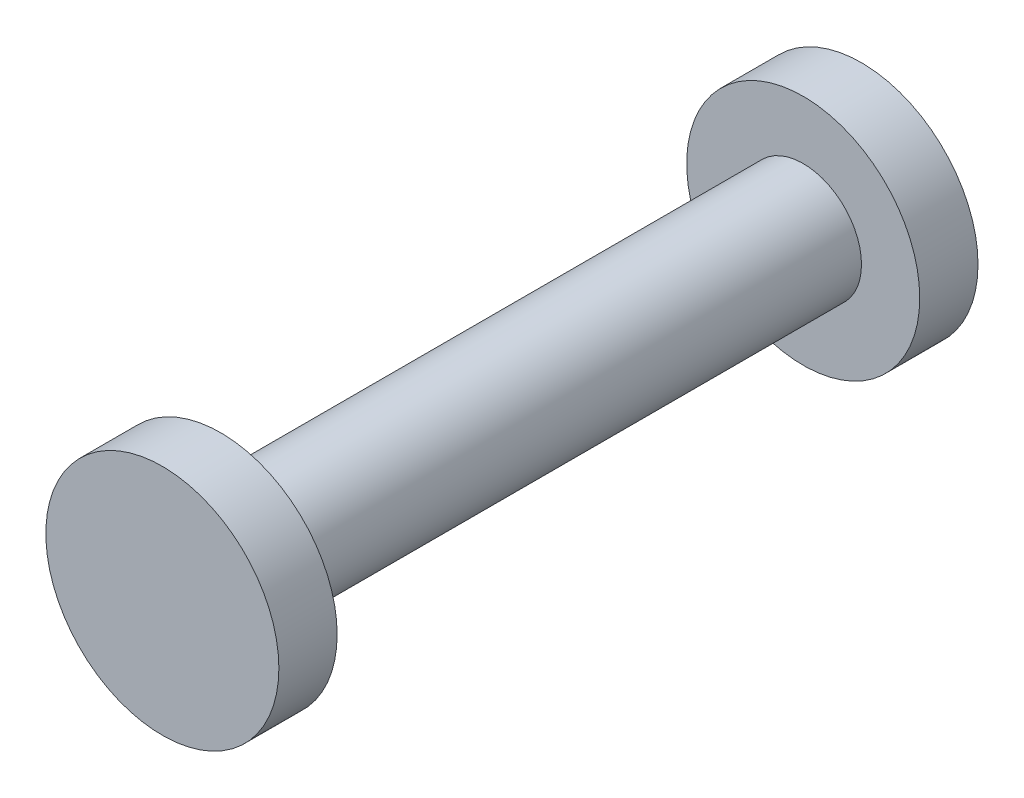
from build123d import *

# Parameters (mm, degrees)
SKETCH1_R           = 5
BOSS_EXTRUDE1_DEPTH = 25
SKETCH2_R           = 10
BOSS_EXTRUDE2_DEPTH = 5


with BuildPart() as part:
    # Sketch1 → Boss-Extrude1 (new, symmetric)
    with BuildSketch(Plane.XY):
        Circle(SKETCH1_R)
    extrude(amount=BOSS_EXTRUDE1_DEPTH, both=True)

    # Sketch2 → Boss-Extrude2 (add)
    with BuildSketch(Plane.XY.offset(25)):
        Circle(SKETCH2_R)
    boss_extrude2 = extrude(amount=BOSS_EXTRUDE2_DEPTH)

    # Mirror2: Boss-Extrude2 across plane
    add(boss_extrude2.mirror(Plane.XY))


solid = part.part
